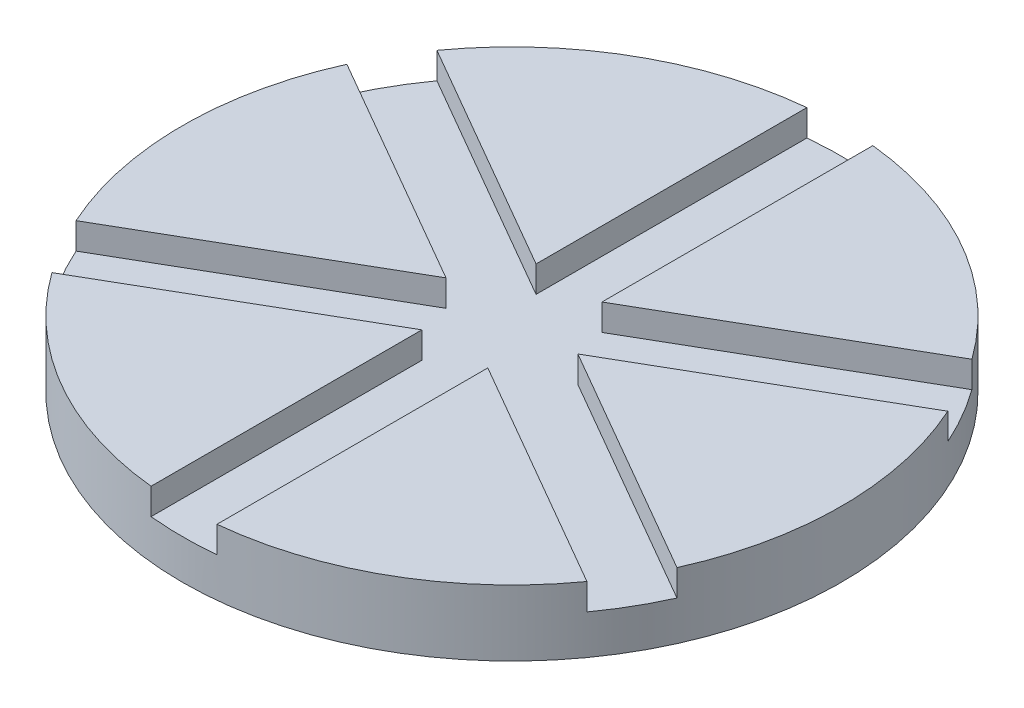
from build123d import *

# Parameters (mm, degrees)
SKETCH1_R           = 127
BOSS_EXTRUDE1_DEPTH = 25.4
CUT_EXTRUDE1_DEPTH  = 10.16
SKETCH3_R           = 12.7
BOSS_EXTRUDE2_DEPTH = 38.1


with BuildPart() as part:
    # Sketch1 → Boss-Extrude1 (new body)
    with BuildSketch(Plane(origin=(0, 0, 0), x_dir=(1, 0, 0), z_dir=(0, 1, 0))):
        with Locations(Location((0, 0, 0), (0, 0, 270))):
            Circle(SKETCH1_R)
    extrude(amount=BOSS_EXTRUDE1_DEPTH)

    # Sketch2 → Cut-Extrude1 (cut)
    with BuildSketch(Plane(origin=(0, 25.4, 0), x_dir=(1, 0, 0), z_dir=(0, 1, 0))):
        Polygon((12.7, -127), (12.7, -21.997045256), (103.635226281, -74.498522628), (138.332271537, -74.498522628), (116.335226281, -52.501477372), (25.4, 0), (116.335226281, 52.501477372), (130.311019476, 77.4940315), (103.635226281, 74.498522628), (12.7, 21.997045256), (12.7, 127), (0, 157.984531472), (-12.7, 127), (-12.7, 21.997045256), (-103.635226281, 74.498522628), (-124.892355956, 78.379341128), (-116.335226281, 52.501477372), (-25.4, 0), (-116.335226281, -52.501477372), (-133.449485631, -77.846459753), (-103.635226281, -74.498522628), (-12.7, -21.997045256), (-12.7, -127), (12.7, -156.136703653), align=None)
    extrude(amount=-CUT_EXTRUDE1_DEPTH, mode=Mode.SUBTRACT)

    # Sketch3 → Boss-Extrude2 (add)
    with BuildSketch(Plane(origin=(0, 0, 0), x_dir=(-1, 0, 0), z_dir=(0, -1, 0))):
        with Locations(Location((0, 0, 0), (0, 0, 270))):
            Circle(SKETCH3_R)
    extrude(amount=BOSS_EXTRUDE2_DEPTH)


solid = part.part
